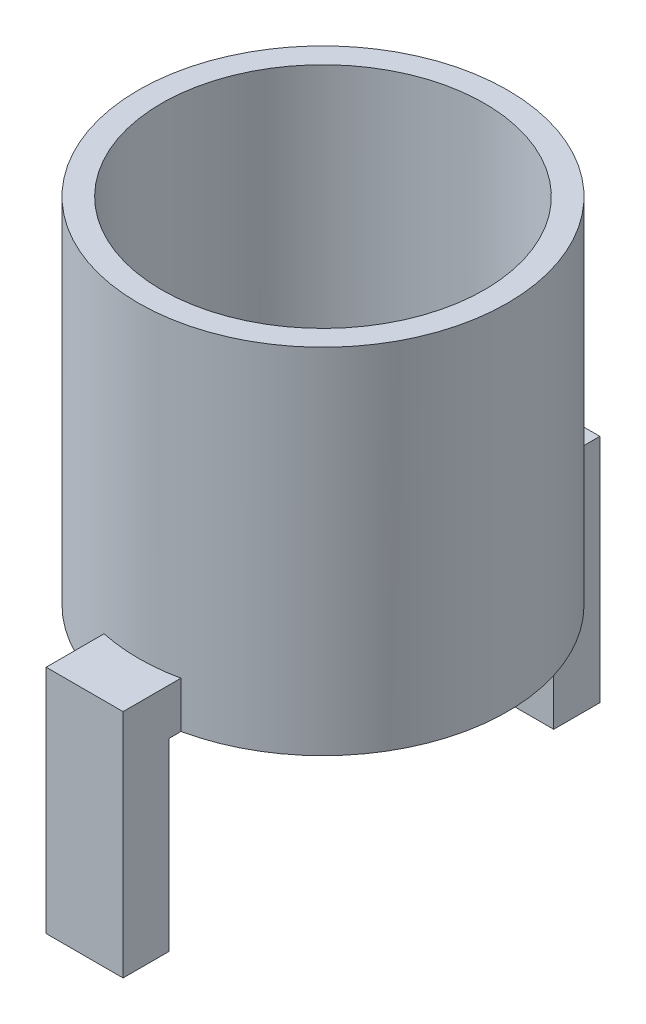
from build123d import *

# Parameters (mm, degrees)
SKETCH1_W                = 5
SKETCH1_H                = 3
BOSS_EXTRUDE1_DEPTH      = 15
BOSS_EXTRUDE1_2_DEPTH    = 15
BOSS_EXTRUDE2_DEPTH      = 20
BOSS_EXTRUDE2_DEPTH_BACK = 3
SKETCH2_R                = 12
SKETCH4_W                = 5
SKETCH4_H                = 3.004832049
BOSS_EXTRUDE3_DEPTH      = 28
SKETCH3_R                = 10.5
CUT_EXTRUDE1_DEPTH       = 25


with BuildPart() as part:
    # Sketch1 → Boss-Extrude1 (new body)
    with BuildSketch(Plane(origin=(0, 0, 0), x_dir=(1, 0, 0), z_dir=(0, 1, 0))):
        with Locations((0, -14)):
            Rectangle(SKETCH1_W, SKETCH1_H)
    extrude(amount=BOSS_EXTRUDE1_DEPTH)



with BuildPart() as body_2:
    # Sketch1 → Boss-Extrude1 2 (new body)
    with BuildSketch(Plane(origin=(0, 0, 0), x_dir=(1, 0, 0), z_dir=(0, 1, 0))):
        with Locations((0, 14)):
            Rectangle(SKETCH1_W, SKETCH1_H)
    extrude(amount=BOSS_EXTRUDE1_2_DEPTH)


with BuildPart() as body_3:
    # Sketch2 → Boss-Extrude2 (new, two sides: drawn at the far end of the back side and taken through both)
    with BuildSketch(Plane(origin=(0, 15, 0), x_dir=(1, 0, 0), z_dir=(0, 1, 0)).offset(-BOSS_EXTRUDE2_DEPTH_BACK)):
        with Locations(Location((0, 0, 0), (0, 0, 270))):
            Circle(SKETCH2_R)
    extrude(amount=BOSS_EXTRUDE2_DEPTH + BOSS_EXTRUDE2_DEPTH_BACK)


with BuildPart() as part_1:
    add(part.part)

    add(body_2.part)  # Boss-Extrude3 merges body 2

    add(body_3.part)  # Boss-Extrude3 merges body 3
    # Sketch4 → Boss-Extrude3 (add)
    with BuildSketch(Plane.XY.offset(-12.5)):
        with Locations((0, 13.497583976)):
            Rectangle(SKETCH4_W, SKETCH4_H)
    extrude(amount=BOSS_EXTRUDE3_DEPTH)

    # Sketch3 → Cut-Extrude1 (cut)
    with BuildSketch(Plane(origin=(0, 35, 0), x_dir=(1, 0, 0), z_dir=(0, 1, 0))):
        with Locations(Location((0, 0, 0), (0, 0, 270))):
            Circle(SKETCH3_R)
    extrude(amount=-CUT_EXTRUDE1_DEPTH, mode=Mode.SUBTRACT)


solid = part_1.part
